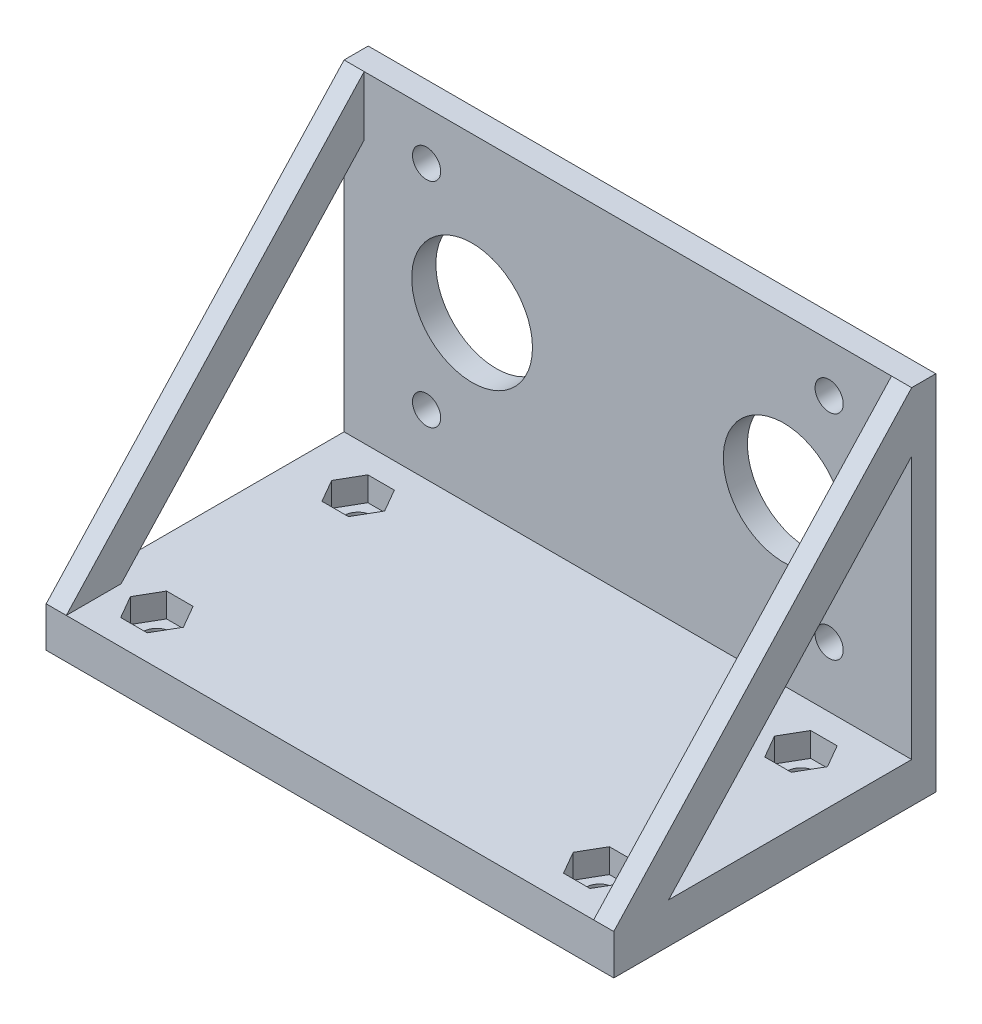
from build123d import *

# Parameters (mm, degrees)
SKETCH_1_W          = 64.5
SKETCH_1_H          = 45
EXTRUDE_1_DEPTH     = 3
HOLE_WIZARD_1_D     = 3.5
HOLE_WIZARD_2_D     = 15
SKETCH_7_W          = 64.5
SKETCH_7_H          = 5
EXTRUDE_2_DEPTH     = 37
HOLE_WIZARD_3_D     = 3.5
CUT_EXTRUDE_1_DEPTH = 3
EXTRUDE_3_DEPTH     = 3
SKETCH_15_W         = 65.5
SKETCH_15_H         = 37
CUT_EXTRUDE_2_DEPTH = 40


with BuildPart() as part:
    # 草图1 → 凸台-拉伸1 (new body)
    with BuildSketch(Plane.XY):
        with Locations((32.25, 22.5)):
            Rectangle(SKETCH_1_W, SKETCH_1_H)
    extrude(amount=EXTRUDE_1_DEPTH)

    # 孔1 (through all)
    with Locations(Plane.XY.offset(3)):
        with Locations((7.25, 39), (57.25, 39), (57.25, 12.5), (7.25, 12.5)):
            Hole(HOLE_WIZARD_1_D / 2)

    # 孔2 (through all)
    with Locations(Plane.XY.offset(3)):
        with Locations((12.9, 25.75), (51.6, 25.75)):
            Hole(HOLE_WIZARD_2_D / 2)

    # 草图7 → 凸台-拉伸2 (add)
    with BuildSketch(Plane.XY.offset(3)):
        with Locations((32.25, 2.5)):
            Rectangle(SKETCH_7_W, SKETCH_7_H)
    extrude(amount=EXTRUDE_2_DEPTH)

    # 孔3 (through all)
    with Locations(Plane(origin=(0, 0, 0), x_dir=(-1, 0, 0), z_dir=(0, -1, 0))):
        with Locations((-4.75, -34), (-4.75, -9), (-59.75, -9), (-59.75, -34)):
            Hole(HOLE_WIZARD_3_D / 2)

    # 草图11 → 切除-拉伸1 (cut)
    with BuildSketch(Plane(origin=(0, 5, 0), x_dir=(1, 0, 0), z_dir=(0, 1, 0))):
        Polygon((63.040896534, -9), (61.395448267, -6.15), (58.104551733, -6.15), (56.459103466, -9), (58.104551733, -11.85), (61.395448267, -11.85), align=None)
        Polygon((63.040896534, -34), (61.395448267, -31.15), (58.104551733, -31.15), (56.459103466, -34), (58.104551733, -36.85), (61.395448267, -36.85), align=None)
        Polygon((8.040896534, -34), (6.395448267, -31.15), (3.104551733, -31.15), (1.459103466, -34), (3.104551733, -36.85), (6.395448267, -36.85), align=None)
        Polygon((8.040896534, -9), (6.395448267, -6.15), (3.104551733, -6.15), (1.459103466, -9), (3.104551733, -11.85), (6.395448267, -11.85), align=None)
    extrude(amount=-CUT_EXTRUDE_1_DEPTH, mode=Mode.SUBTRACT)

    # 草图14 → 凸台-拉伸3 (add)
    with BuildSketch(Plane.ZY):
        Polygon((3, 45), (0, 45), (0, 0), (40, 0), (40, 5), (33.188933637, 5), (3, 5), (3, 37.636685013), align=None)
        Polygon((40, 5), (3, 45), (3, 37.636685013), (33.188933637, 5), align=None)
    extrude_3 = extrude(amount=EXTRUDE_3_DEPTH)

    # 镜向1: 凸台-拉伸3 across plane
    add(extrude_3.mirror(Plane.ZY.offset(-32.25)))

    # 草图15 → 切除-拉伸2 (cut)
    with BuildSketch(Plane(origin=(0, 5, 0), x_dir=(1, 0, 0), z_dir=(0, 1, 0))):
        with Locations((32.25, -21.5)):
            Rectangle(SKETCH_15_W, SKETCH_15_H)
    extrude(amount=CUT_EXTRUDE_2_DEPTH, mode=Mode.SUBTRACT)


solid = part.part
